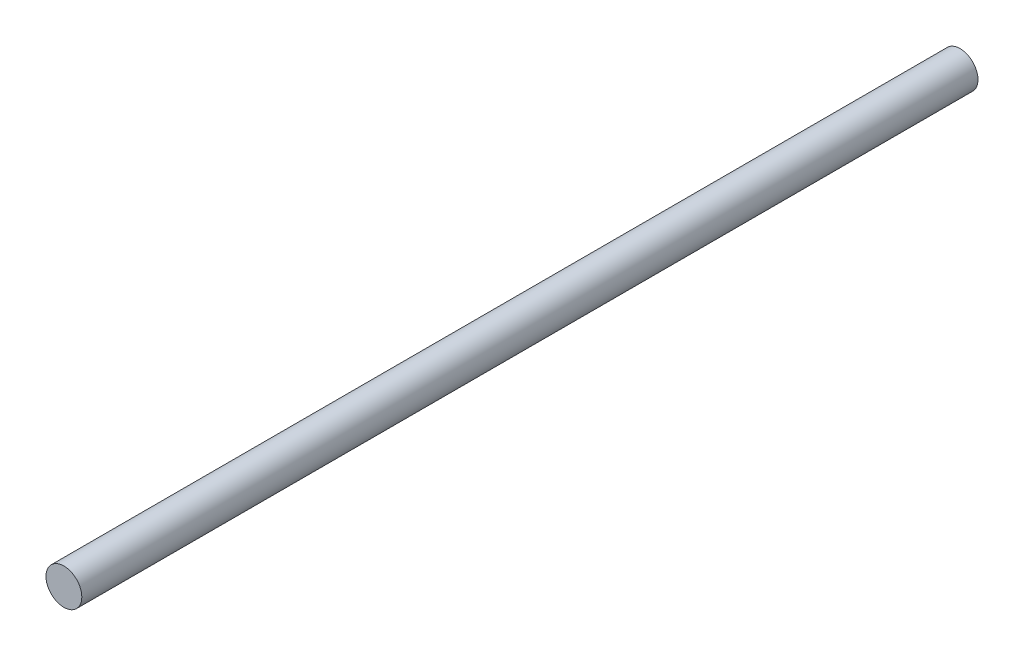
from build123d import *

# Parameters (mm, degrees)
SKETCH1_R           = 3
BOSS_EXTRUDE1_DEPTH = 75


with BuildPart() as part:
    # Sketch1 → Boss-Extrude1 (new, symmetric)
    with BuildSketch(Plane.XY):
        Circle(SKETCH1_R)
    extrude(amount=BOSS_EXTRUDE1_DEPTH, both=True)


solid = part.part
